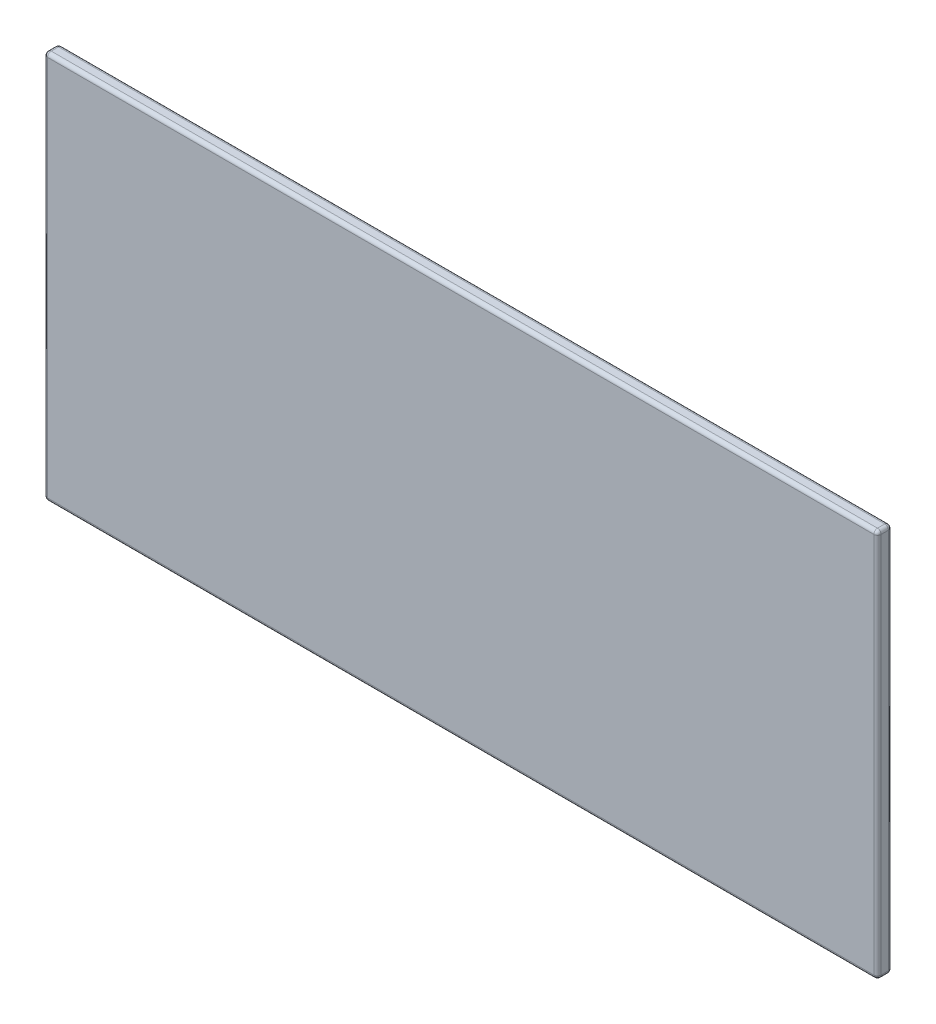
from build123d import *

# Parameters (mm, degrees)
SKETCH1_W           = 114.7
SKETCH1_H           = 53.5
BOSS_EXTRUDE1_DEPTH = 2
FILLET1_R           = 0.5


with BuildPart() as part:
    # Sketch1 → Boss-Extrude1 (new body)
    with BuildSketch(Plane.XY):
        Rectangle(SKETCH1_W, SKETCH1_H)
    extrude(amount=BOSS_EXTRUDE1_DEPTH)

    # Fillet1
    fillet1_edges = [part.edges().sort_by_distance(p)[0] for p in [
        (-57.35, 0, 2),
        (0, -26.75, 2),
        (57.35, 0, 2),
        (0, -26.75, 0),
        (-57.35, 0, 0),
        (0, 26.75, 0),
        (57.35, 0, 0),
        (57.35, -26.75, 1),
        (-57.35, -26.75, 1),
        (-57.35, 26.75, 1),
        (57.35, 26.75, 1),
        (0, 26.75, 2),
    ]]
    fillet(fillet1_edges, radius=FILLET1_R)


solid = part.part
